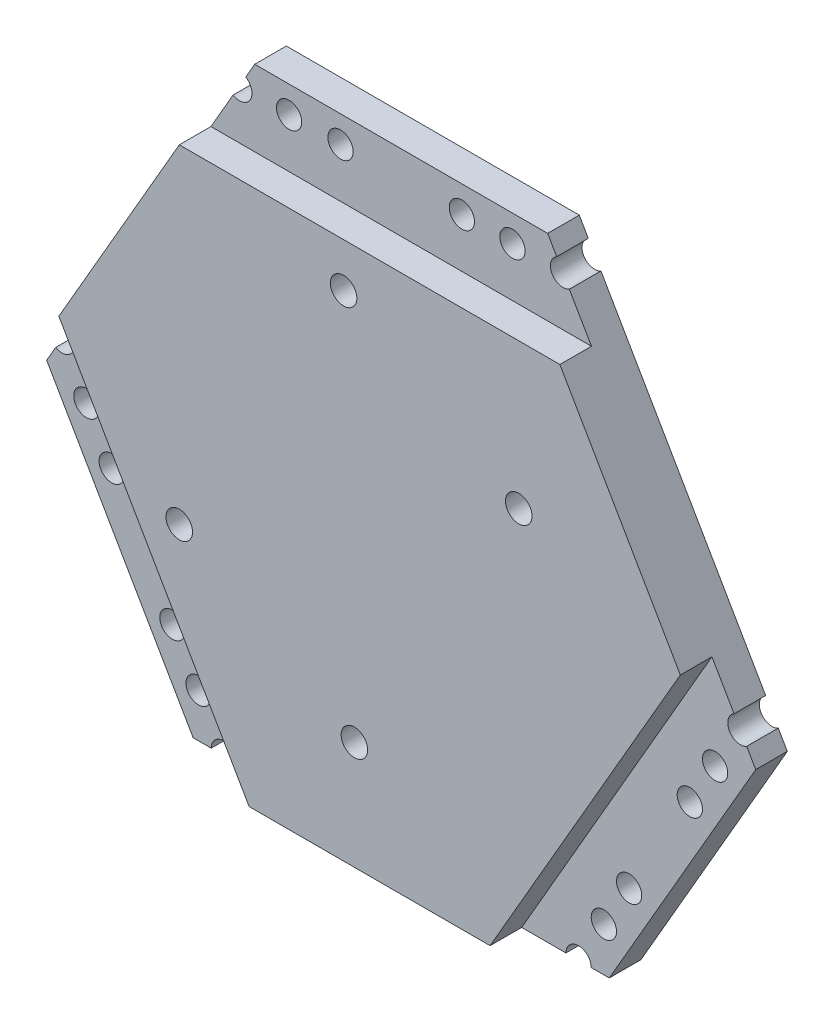
from build123d import *

# Parameters (mm, degrees)
EXTRUDE_4_DEPTH      = 10
SKETCH_2_R           = 2.1
CUT_EXTRUDE_1_DEPTH  = 104.128172694
SKETCH_4_W           = 60.2
SKETCH_4_H           = 12
CUT_EXTRUDE_2_DEPTH  = 5
CUT_EXTRUDE_9_DEPTH  = 125.764203881
EXTRUDE_5_DEPTH      = 3
CUT_EXTRUDE_10_DEPTH = 6
FILLET_1_R           = 2
FILLET_2_R           = 2
SKETCH_10_R          = 0.65
CUT_EXTRUDE_11_DEPTH = 6
CUT_EXTRUDE_12_DEPTH = 127.561979888
CUT_EXTRUDE_13_DEPTH = 124.620047186


with BuildPart() as part:
    # 草圖1 → 填料-伸長4 (new body)
    with BuildSketch(Plane.XY):
        Polygon((49.802669845, 25.924393386), (-10.397330155, 25.924393386), (-29.457330155, -7.088495007), (0.642669845, -59.223224314), (38.762669845, -59.223224314), (68.862669845, -7.088495007), align=None)
        with BuildLine():
            Line((-0.037670798, 33.71862202), (-3.897330155, 33.71862202))
            ThreePointArc((-3.897330155, 33.71862202), (-4.897330155, 31.986571212), (-6.897330155, 31.986571212))
            Line((-6.897330155, 31.986571212), (-10.397330155, 25.924393386))
            Line((-10.397330155, 25.924393386), (49.802669845, 25.924393386))
            Line((49.802669845, 25.924393386), (46.302669845, 31.986571212))
            ThreePointArc((46.302669845, 31.986571212), (44.302669845, 31.986571212), (43.302669845, 33.71862202))
            Line((43.302669845, 33.71862202), (39.302669845, 33.71862202))
            ThreePointArc((39.302669845, 33.71862202), (37.302669845, 31.71862202), (35.302669845, 33.71862202))
            Line((35.302669845, 33.71862202), (31.302669845, 33.71862202))
            ThreePointArc((31.302669845, 33.71862202), (29.302669845, 31.71862202), (27.302669845, 33.71862202))
            Line((27.302669845, 33.71862202), (12.102669845, 33.71862202))
            ThreePointArc((12.102669845, 33.71862202), (10.102669845, 31.71862202), (8.102669845, 33.71862202))
            Line((8.102669845, 33.71862202), (3.962329202, 33.71862202))
            ThreePointArc((3.962329202, 33.71862202), (1.962329202, 31.71862202), (-0.037670798, 33.71862202))
        make_face()
        with BuildLine():
            ThreePointArc((-6.897330155, 31.986571212), (-6.897330155, 35.450672827), (-3.897330155, 33.71862202))
            Line((-3.897330155, 33.71862202), (-0.037670798, 33.71862202))
            ThreePointArc((-0.037670798, 33.71862202), (1.962329202, 35.71862202), (3.962329202, 33.71862202))
            Line((3.962329202, 33.71862202), (8.102669845, 33.71862202))
            ThreePointArc((8.102669845, 33.71862202), (10.102669845, 35.71862202), (12.102669845, 33.71862202))
            Line((12.102669845, 33.71862202), (27.302669845, 33.71862202))
            ThreePointArc((27.302669845, 33.71862202), (29.302669845, 35.71862202), (31.302669845, 33.71862202))
            Line((31.302669845, 33.71862202), (35.302669845, 33.71862202))
            ThreePointArc((35.302669845, 33.71862202), (37.302669845, 35.71862202), (39.302669845, 33.71862202))
            Line((39.302669845, 33.71862202), (43.302669845, 33.71862202))
            ThreePointArc((43.302669845, 33.71862202), (45.302669845, 35.71862202), (47.302669845, 33.71862202))
            ThreePointArc((47.302669845, 33.71862202), (47.034720652, 32.71862202), (46.302669845, 31.986571212))
            Line((46.302669845, 31.986571212), (49.802669845, 25.924393386))
            Line((49.802669845, 25.924393386), (49.802669845, 37.924393386))
            Line((49.802669845, 37.924393386), (-10.397330155, 37.924393386))
            Line((-10.397330155, 37.924393386), (-10.397330155, 25.924393386))
            Line((-10.397330155, 25.924393386), (-6.897330155, 31.986571212))
        make_face()
        with BuildLine():
            Line((-32.957330155, -13.150672833), (-29.457330155, -7.088495007))
            Line((-29.457330155, -7.088495007), (-39.849635001, -13.088495007))
            Line((-39.849635001, -13.088495007), (-9.749635001, -65.223224314))
            Line((-9.749635001, -65.223224314), (0.642669845, -59.223224314))
            Line((0.642669845, -59.223224314), (-6.357330155, -59.223224314))
            ThreePointArc((-6.357330155, -59.223224314), (-9.357330155, -60.955275122), (-9.357330155, -57.491173507))
            Line((-9.357330155, -57.491173507), (-11.357330155, -54.027071892))
            ThreePointArc((-11.357330155, -54.027071892), (-14.089380963, -53.295021084), (-13.357330155, -50.562970277))
            Line((-13.357330155, -50.562970277), (-15.394263476, -47.034898273))
            ThreePointArc((-15.394263476, -47.034898273), (-18.229721605, -46.366817854), (-17.390567155, -43.577198874))
            Line((-17.390567155, -43.577198874), (-24.994263476, -30.40721052))
            ThreePointArc((-24.994263476, -30.40721052), (-27.829721605, -29.739130101), (-26.990567155, -26.949511121))
            Line((-26.990567155, -26.949511121), (-28.994263476, -23.47900729))
            ThreePointArc((-28.994263476, -23.47900729), (-31.829721605, -22.810926871), (-30.990567155, -20.021307891))
            Line((-30.990567155, -20.021307891), (-32.957330155, -16.614774448))
            ThreePointArc((-32.957330155, -16.614774448), (-35.957330155, -14.882723641), (-32.957330155, -13.150672833))
        make_face()
        with BuildLine():
            Line((0.642669845, -59.223224314), (-29.457330155, -7.088495007))
            Line((-29.457330155, -7.088495007), (-32.957330155, -13.150672833))
            ThreePointArc((-32.957330155, -13.150672833), (-32.225279348, -13.882723641), (-31.957330155, -14.882723641))
            ThreePointArc((-31.957330155, -14.882723641), (-32.225279348, -15.882723641), (-32.957330155, -16.614774448))
            Line((-32.957330155, -16.614774448), (-30.990567155, -20.021307891))
            ThreePointArc((-30.990567155, -20.021307891), (-29.045480871, -20.110075214), (-28.097670798, -21.810926871))
            ThreePointArc((-28.097670798, -21.810926871), (-28.336021763, -22.75781265), (-28.994263476, -23.47900729))
            Line((-28.994263476, -23.47900729), (-26.990567155, -26.949511121))
            ThreePointArc((-26.990567155, -26.949511121), (-25.045480871, -27.038278445), (-24.097670798, -28.739130101))
            ThreePointArc((-24.097670798, -28.739130101), (-24.336021763, -29.68601588), (-24.994263476, -30.40721052))
            Line((-24.994263476, -30.40721052), (-17.390567155, -43.577198874))
            ThreePointArc((-17.390567155, -43.577198874), (-15.445480871, -43.665966197), (-14.497670798, -45.366817854))
            ThreePointArc((-14.497670798, -45.366817854), (-14.736021763, -46.313703633), (-15.394263476, -47.034898273))
            Line((-15.394263476, -47.034898273), (-13.357330155, -50.562970277))
            ThreePointArc((-13.357330155, -50.562970277), (-11.357330155, -50.562970277), (-10.357330155, -52.295021084))
            ThreePointArc((-10.357330155, -52.295021084), (-10.625279348, -53.295021084), (-11.357330155, -54.027071892))
            Line((-11.357330155, -54.027071892), (-9.357330155, -57.491173507))
            ThreePointArc((-9.357330155, -57.491173507), (-7.357330155, -57.491173507), (-6.357330155, -59.223224314))
            Line((-6.357330155, -59.223224314), (0.642669845, -59.223224314))
        make_face()
        with BuildLine():
            Line((79.25497469, -13.088495007), (68.862669845, -7.088495007))
            Line((68.862669845, -7.088495007), (72.362669845, -13.150672833))
            ThreePointArc((72.362669845, -13.150672833), (74.362669845, -13.150672833), (75.362669845, -14.882723641))
            ThreePointArc((75.362669845, -14.882723641), (74.362669845, -16.614774448), (72.362669845, -16.614774448))
            Line((72.362669845, -16.614774448), (70.362669845, -20.078876063))
            ThreePointArc((70.362669845, -20.078876063), (71.094720652, -20.810926871), (71.362669845, -21.810926871))
            ThreePointArc((71.362669845, -21.810926871), (70.362669845, -23.542977679), (68.362669845, -23.542977679))
            Line((68.362669845, -23.542977679), (66.362669845, -27.007079294))
            ThreePointArc((66.362669845, -27.007079294), (67.094720652, -27.739130101), (67.362669845, -28.739130101))
            ThreePointArc((67.362669845, -28.739130101), (66.362669845, -30.471180909), (64.362669845, -30.471180909))
            Line((64.362669845, -30.471180909), (56.762669845, -43.634767046))
            ThreePointArc((56.762669845, -43.634767046), (57.494720652, -44.366817854), (57.762669845, -45.366817854))
            ThreePointArc((57.762669845, -45.366817854), (56.762669845, -47.098868661), (54.762669845, -47.098868661))
            Line((54.762669845, -47.098868661), (52.762669845, -50.562970277))
            ThreePointArc((52.762669845, -50.562970277), (53.494720652, -51.295021084), (53.762669845, -52.295021084))
            ThreePointArc((53.762669845, -52.295021084), (52.762669845, -54.027071892), (50.762669845, -54.027071892))
            Line((50.762669845, -54.027071892), (48.762669845, -57.491173507))
            ThreePointArc((48.762669845, -57.491173507), (49.494720652, -58.223224314), (49.762669845, -59.223224314))
            ThreePointArc((49.762669845, -59.223224314), (47.762669845, -61.223224314), (45.762669845, -59.223224314))
            Line((45.762669845, -59.223224314), (38.762669845, -59.223224314))
            Line((38.762669845, -59.223224314), (49.15497469, -65.223224314))
            Line((49.15497469, -65.223224314), (79.25497469, -13.088495007))
        make_face()
        with BuildLine():
            Line((72.362669845, -13.150672833), (68.862669845, -7.088495007))
            Line((68.862669845, -7.088495007), (38.762669845, -59.223224314))
            Line((38.762669845, -59.223224314), (45.762669845, -59.223224314))
            ThreePointArc((45.762669845, -59.223224314), (46.762669845, -57.491173507), (48.762669845, -57.491173507))
            Line((48.762669845, -57.491173507), (50.762669845, -54.027071892))
            ThreePointArc((50.762669845, -54.027071892), (50.030619037, -51.295021084), (52.762669845, -50.562970277))
            Line((52.762669845, -50.562970277), (54.762669845, -47.098868661))
            ThreePointArc((54.762669845, -47.098868661), (54.030619037, -44.366817854), (56.762669845, -43.634767046))
            Line((56.762669845, -43.634767046), (64.362669845, -30.471180909))
            ThreePointArc((64.362669845, -30.471180909), (63.630619037, -27.739130101), (66.362669845, -27.007079294))
            Line((66.362669845, -27.007079294), (68.362669845, -23.542977679))
            ThreePointArc((68.362669845, -23.542977679), (67.630619037, -20.810926871), (70.362669845, -20.078876063))
            Line((70.362669845, -20.078876063), (72.362669845, -16.614774448))
            ThreePointArc((72.362669845, -16.614774448), (71.362669845, -14.882723641), (72.362669845, -13.150672833))
        make_face()
    extrude(amount=EXTRUDE_4_DEPTH)

    # 草圖2 → 除料-伸長1 (cut, through all)
    with BuildSketch(Plane(origin=(0, 0, 0), x_dir=(-1, 0, 0), z_dir=(0, 0, -1))):
        with Locations((10.410669672, -26.098711335)):
            Circle(SKETCH_2_R)
        with Locations((-15.589330328, 18.934609661)):
            Circle(SKETCH_2_R)
        with Locations((-43.302143249, 2.934609661)):
            Circle(SKETCH_2_R)
        with Locations((-17.302143249, -42.098711335)):
            Circle(SKETCH_2_R)
    extrude(amount=-CUT_EXTRUDE_1_DEPTH, mode=Mode.SUBTRACT)

    # 草圖4 → 除料-伸長2 (cut)
    with BuildSketch(Plane.XY.offset(10)):
        Polygon((38.762669845, -59.223224314), (49.15497469, -65.223224314), (79.264488572, -13.07201648), (68.872183727, -7.07201648), align=None)
        with Locations((19.702669845, 31.924393386)):
            Rectangle(SKETCH_4_W, SKETCH_4_H)
        Polygon((-29.457330155, -7.088495007), (-39.849635001, -13.088495007), (-9.472158735, -65.703827304), (0.92014611, -59.703827304), align=None)
    extrude(amount=-CUT_EXTRUDE_2_DEPTH, mode=Mode.SUBTRACT)

    # 草圖7 → 除料-伸長9 (cut, through all)
    with BuildSketch(Plane(origin=(-19.023589241, 10.983274369, 0), x_dir=(0, 0, 1), z_dir=(-0.8660254037844398, 0.49999999999999806, 0))):
        Polygon((5, -20.867481828), (0, -20.867481828), (0, -53.816238545), (10, -53.816238545), (10, -20.867481828), align=None)
        Polygon((0, 46.26799966), (0, 17.252518172), (5, 17.252518172), (10, 17.252518172), (10, 46.26799966), align=None)
    extrude(amount=CUT_EXTRUDE_9_DEPTH, mode=Mode.SUBTRACT)

    # 草圖8 → 填料-伸長5 (add)
    with BuildSketch(Plane(origin=(0, 0, 0), x_dir=(-1, 0, 0), z_dir=(0, 0, -1))):
        Polygon((-19.704067038, -31.938457298), (2.812593461, -18.938457298), (-13.187406539, 8.774355623), (-35.704067038, -4.225644377), align=None)
    extrude(amount=EXTRUDE_5_DEPTH)

    # 草圖9 → 除料-伸長10 (cut)
    with BuildSketch(Plane(origin=(0, 0, -3), x_dir=(-1, 0, 0), z_dir=(0, 0, -1))):
        Polygon((-19.338041634, -30.572431894), (1.446568057, -18.572431894), (-13.553431943, 7.40833022), (-34.338041634, -4.59166978), align=None)
    extrude(amount=-CUT_EXTRUDE_10_DEPTH, mode=Mode.SUBTRACT)

    # 圓角1
    fillet_1_edges = [part.edges().sort_by_distance(p)[0] for p in [
        (19.338041634, -30.572431894, 0),
        (34.338041634, -4.59166978, 0),
        (13.553431943, 7.40833022, 0),
        (-1.446568057, -18.572431894, 0),
    ]]
    fillet(fillet_1_edges, radius=FILLET_1_R)

    # 圓角2
    fillet_2_edges = [part.edges().sort_by_distance(p)[0] for p in [
        (35.704067038, -4.225644377, -1.5),
        (19.704067038, -31.938457298, -1.5),
        (-2.812593461, -18.938457298, -1.5),
        (13.187406539, 8.774355623, -1.5),
    ]]
    fillet(fillet_2_edges, radius=FILLET_2_R)

    # 草圖10 → 除料-伸長11 (cut)
    with BuildSketch(Plane(origin=(0, 0, 3), x_dir=(-1, 0, 0), z_dir=(0, 0, -1))):
        with Locations((-28.190927317, -6.238784097)):
            Circle(SKETCH_10_R)
        with Locations((-15.20054626, 1.261215903)):
            Circle(SKETCH_10_R)
        with Locations((-4.70054626, -16.925317577)):
            Circle(SKETCH_10_R)
        with Locations((-17.690927317, -24.425317577)):
            Circle(SKETCH_10_R)
        Polygon((-2.303431943, -12.077241365), (-9.803431943, 0.913139691), (-30.587870887, -11.086761728), (-23.087870887, -24.077142785), align=None)
    extrude(amount=-CUT_EXTRUDE_11_DEPTH, mode=Mode.SUBTRACT)

    # 草圖12 → 除料-伸長12 (cut, through all)
    with BuildSketch(Plane(origin=(48.577594008, 28.046286977, 0), x_dir=(0, 0, -1), z_dir=(0.8660254037844363, 0.5000000000000042, 0))):
        Polygon((0, -70.38008838), (0, -40.570151673), (-5, -40.570151673), (-10, -40.570151673), (-10, -70.38008838), align=None)
        Polygon((-5, -2.450151673), (0, -2.450151673), (0, 27.877960609), (-10, 27.877960609), (-10, -2.450151673), align=None)
    extrude(amount=CUT_EXTRUDE_12_DEPTH, mode=Mode.SUBTRACT)

    # 草圖13 → 除料-伸長13 (cut, through all)
    with BuildSketch(Plane.XZ.offset(59.223224314)):
        Polygon((66.260162627, 10), (38.762669845, 10), (38.762669845, 5), (38.762669845, 0), (66.260162627, 0), align=None)
        Polygon((0.642669845, 5), (0.642669845, 10), (-25.338575987, 10), (-25.338575987, 0), (0.642669845, 0), align=None)
    extrude(amount=CUT_EXTRUDE_13_DEPTH, mode=Mode.SUBTRACT)


solid = part.part
